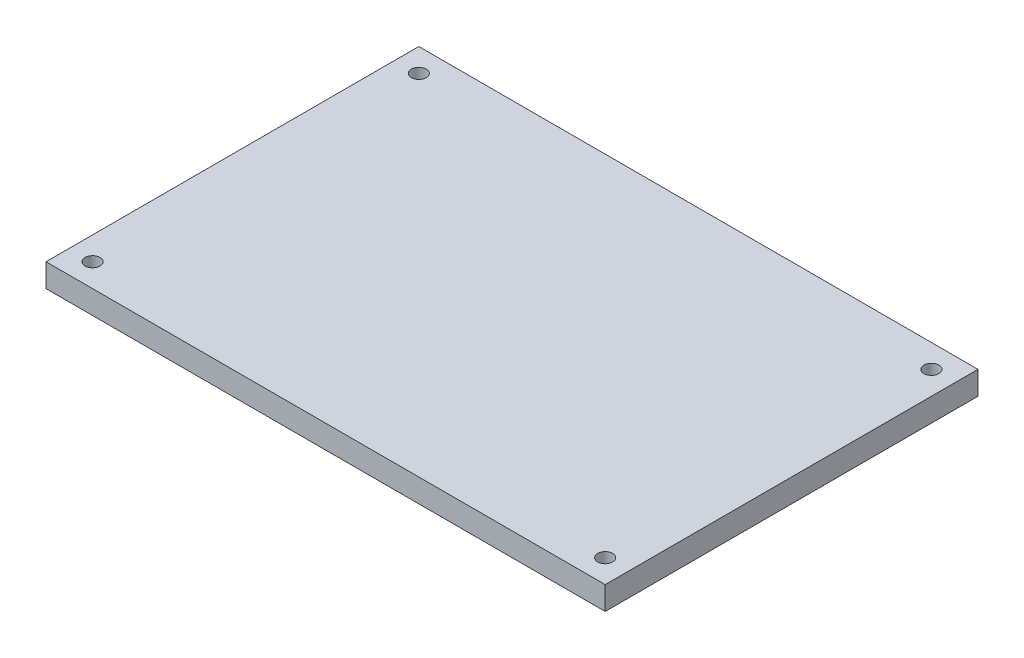
from build123d import *

# Parameters (mm, degrees)
ESQUISSE1_W             = 120
ESQUISSE1_H             = 80
BOSS_EXTRU_1_DEPTH      = 5
ESQUISSE2_R             = 1.6
ENL_V_MAT_EXTRU_3_DEPTH = 10


with BuildPart() as part:
    # Esquisse1 → Boss.-Extru.1 (new body)
    with BuildSketch(Plane(origin=(0, 0, 0), x_dir=(1, 0, 0), z_dir=(0, 1, 0))):
        with Locations((60, 40)):
            Rectangle(ESQUISSE1_W, ESQUISSE1_H)
    extrude(amount=BOSS_EXTRU_1_DEPTH)

    # Esquisse2 → Enlèv. mat.-Extru.3 (cut)
    with BuildSketch(Plane(origin=(0, 0, 0), x_dir=(1, 0, 0), z_dir=(0, 1, 0))):
        with Locations(Location((5, 75, 0), (0, 0, 90))):
            Circle(ESQUISSE2_R)
        with Locations(Location((115, 75, 0), (0, 0, 90))):
            Circle(ESQUISSE2_R)
        with Locations(Location((115, 5, 0), (0, 0, 90))):
            Circle(ESQUISSE2_R)
        with Locations(Location((5, 5, 0), (0, 0, 90))):
            Circle(ESQUISSE2_R)
    extrude(amount=ENL_V_MAT_EXTRU_3_DEPTH, mode=Mode.SUBTRACT)


solid = part.part
